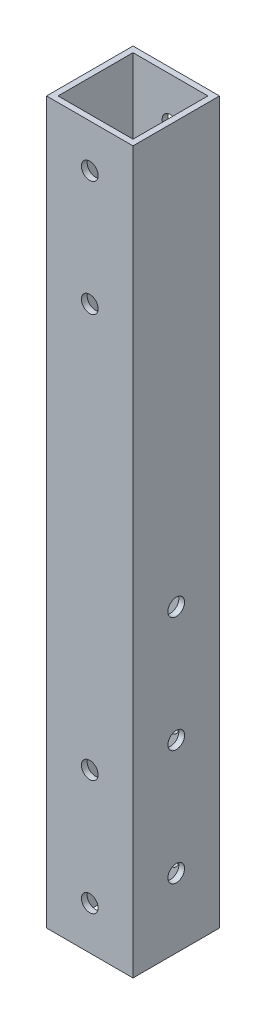
from build123d import *

# Parameters (mm, degrees)
SKETCH_1_W          = 15
SKETCH_1_H          = 15
SKETCH_1_W_2        = 13
SKETCH_1_H_2        = 13
EXTRUDE_1_DEPTH     = 125
SKETCH_2_R          = 1.45
CUT_EXTRUDE_1_DEPTH = 127.119982556
SKETCH_3_R          = 1.45
CUT_EXTRUDE_2_DEPTH = 127.119982556


with BuildPart() as part:
    # 草图1 → 拉伸-薄壁1 (new body)
    with BuildSketch(Plane(origin=(0, 0, 0), x_dir=(1, 0, 0), z_dir=(0, 1, 0))):
        Rectangle(SKETCH_1_W, SKETCH_1_H)
        Rectangle(SKETCH_1_W_2, SKETCH_1_H_2, mode=Mode.SUBTRACT)
    extrude(amount=EXTRUDE_1_DEPTH)

    # 草图2 → 切除-拉伸1 (cut, through all)
    with BuildSketch(Plane.XY.offset(7.5)):
        with Locations((0, 7.5)):
            Circle(SKETCH_2_R)
        with Locations((0, 27.5)):
            Circle(SKETCH_2_R)
        with Locations(Location((0, 97.5, 0), (0, 0, 180))):
            Circle(SKETCH_2_R)
        with Locations(Location((0, 117.5, 0), (0, 0, 180))):
            Circle(SKETCH_2_R)
    extrude(amount=-CUT_EXTRUDE_1_DEPTH, mode=Mode.SUBTRACT)

    # 草图3 → 切除-拉伸2 (cut, through all)
    with BuildSketch(Plane(origin=(7.5, 0, 0), x_dir=(0, 0, -1), z_dir=(1, 0, 0))):
        with Locations((0, 32)):
            Circle(SKETCH_3_R)
        with Locations((0, 12)):
            Circle(SKETCH_3_R)
        with Locations((0, 52)):
            Circle(SKETCH_3_R)
    extrude(amount=-CUT_EXTRUDE_2_DEPTH, mode=Mode.SUBTRACT)


solid = part.part
